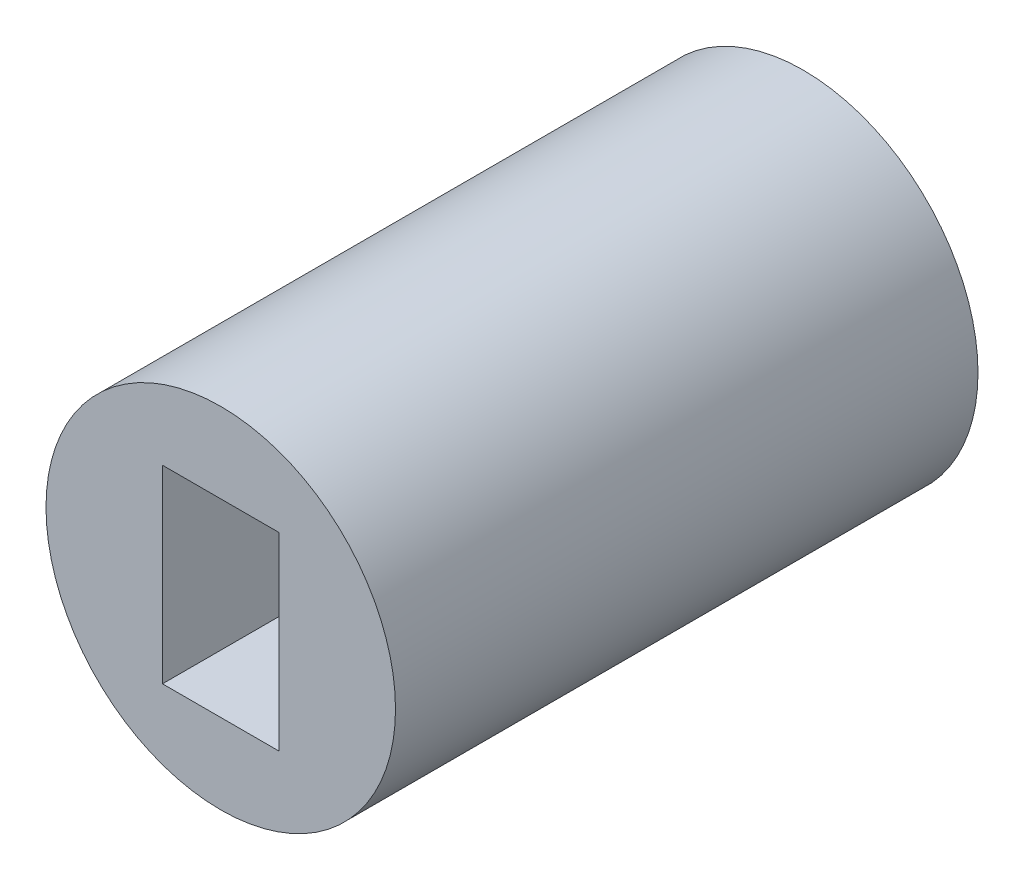
from build123d import *

# Parameters (mm, degrees)
ESQUISSE1_R      = 6
EXTRUSION1_DEPTH = 20
ESQUISSE2_W      = 4
ESQUISSE2_H      = 6.5
EXTRUSION2_DEPTH = 20


with BuildPart() as part:
    # Esquisse1 → Extrusion1 (new body)
    with BuildSketch(Plane.XY):
        Circle(ESQUISSE1_R)
    extrude(amount=EXTRUSION1_DEPTH)

    # Esquisse2 → Extrusion2 (cut)
    with BuildSketch(Plane(origin=(0, 0, 0), x_dir=(-1, 0, 0), z_dir=(0, 0, -1))):
        Rectangle(ESQUISSE2_W, ESQUISSE2_H)
    extrude(amount=-EXTRUSION2_DEPTH, mode=Mode.SUBTRACT)


solid = part.part
